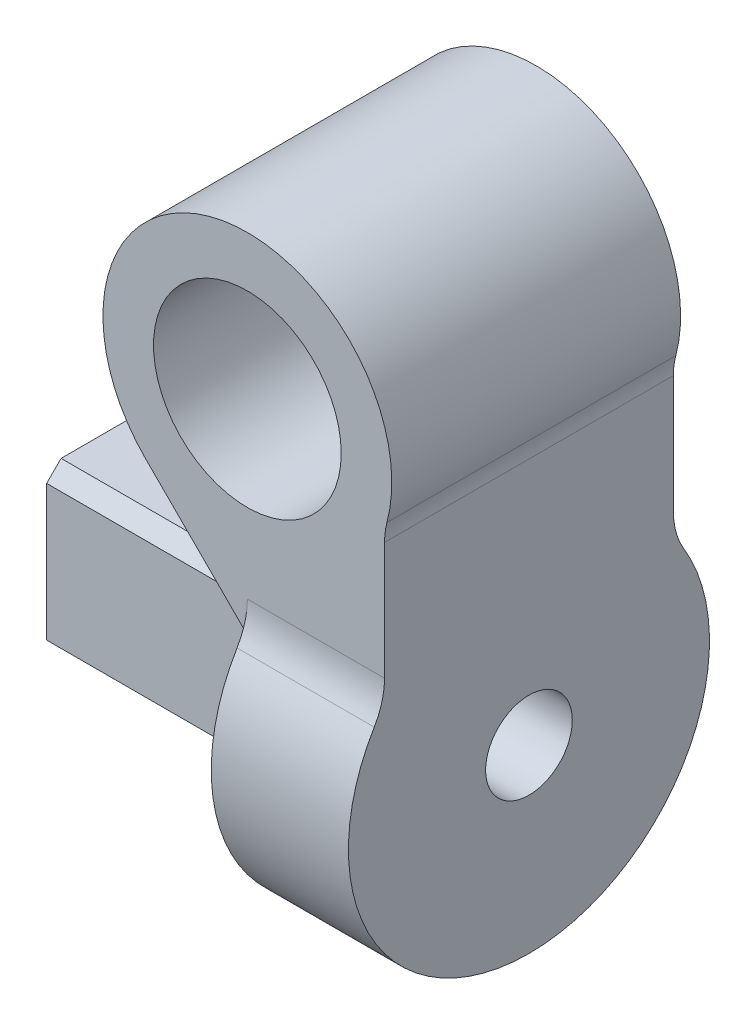
from build123d import *

# Parameters (mm, degrees)
SKETCH1_R           = 62.5
SKETCH1_R_2         = 15
BOSS_EXTRUDE1_DEPTH = 47.5
SKETCH2_R           = 32.5
BOSS_EXTRUDE2_DEPTH = 50
BOSS_EXTRUDE3_START = -47.5
BOSS_EXTRUDE3_DEPTH = 47.5
BOSS_EXTRUDE4_DEPTH = 100
FILLET1_R           = 25
SKETCH5_W           = 57
SKETCH5_H           = 57
BOSS_EXTRUDE5_DEPTH = 91
CHAMFER1_SIZE       = 5


with BuildPart() as part:
    # Sketch1 → Boss-Extrude1 (new body)
    with BuildSketch(Plane(origin=(0, 0, 0), x_dir=(0, 0, -1), z_dir=(1, 0, 0))):
        Circle(SKETCH1_R)
        Circle(SKETCH1_R_2, mode=Mode.SUBTRACT)
    extrude(amount=BOSS_EXTRUDE1_DEPTH)

    # Sketch2 → Boss-Extrude2 (add, symmetric)
    with BuildSketch(Plane.XY):
        with BuildLine():
            Line((-35.355339059, 69.644660941), (0, 34.289321881))
            Line((0, 34.289321881), (0, 55))
            ThreePointArc((0, 55), (19.134171618, 151.193976626), (-35.355339059, 69.644660941))
        make_face()
        with Locations((0, 105)):
            Circle(SKETCH2_R, mode=Mode.SUBTRACT)
    extrude(amount=BOSS_EXTRUDE2_DEPTH, both=True)

    # Sketch3 → Boss-Extrude3 (add)
    with BuildSketch(Plane(origin=(47.5, 0, 0), x_dir=(0, 0, -1), z_dir=(1, 0, 0)).offset(BOSS_EXTRUDE3_START)):
        with BuildLine():
            Line((-50, 55), (-50, 62.5))
            Line((-50, 62.5), (50, 62.5))
            Line((50, 62.5), (50, 55))
            Line((50, 55), (50, 37.5))
            ThreePointArc((50, 37.5), (40.792418173, 47.352176503), (29.685855218, 55))
            Line((29.685855218, 55), (-29.685855218, 55))
            ThreePointArc((-29.685855218, 55), (-40.792418173, 47.352176503), (-50, 37.5))
            Line((-50, 37.5), (-50, 55))
        make_face()
    extrude(amount=BOSS_EXTRUDE3_DEPTH)

    # Sketch4 → Boss-Extrude4 (add)
    with BuildSketch(Plane.XY.offset(50)):
        with BuildLine():
            Line((26.339134382, 62.5), (47.5, 62.5))
            Line((47.5, 62.5), (47.5, 89.387505004))
            ThreePointArc((47.5, 89.387505004), (39.291079432, 74.07733716), (26.339134382, 62.5))
        make_face()
    extrude(amount=-BOSS_EXTRUDE4_DEPTH)

    # Fillet1
    fillet1_edges = [part.edges().sort_by_distance(p)[0] for p in [
        (23.75, 37.5, 50),
        (23.75, 37.5, -50),
        (47.5, 89.387505004, 0),
    ]]
    fillet(fillet1_edges, radius=FILLET1_R)

    # Sketch5 → Boss-Extrude5 (add)
    with BuildSketch(Plane.ZY):
        Rectangle(SKETCH5_W, SKETCH5_H)
    extrude(amount=BOSS_EXTRUDE5_DEPTH)

    # Chamfer1
    chamfer1_edges = [part.edges().sort_by_distance(p)[0] for p in [
        (-45.5, -28.5, 28.5),
        (-45.5, 28.5, 28.5),
        (-45.5, 28.5, -28.5),
        (-45.5, -28.5, -28.5),
    ]]
    chamfer(chamfer1_edges, length=CHAMFER1_SIZE)


solid = part.part
